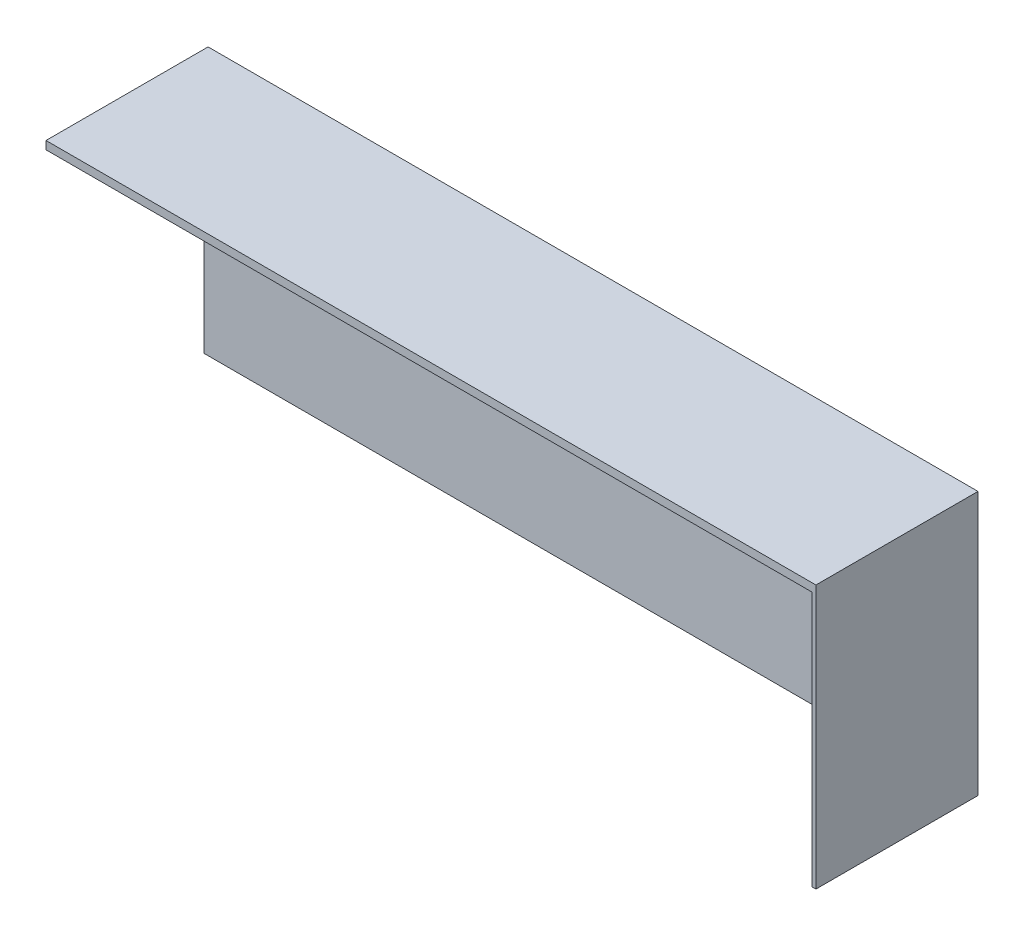
from build123d import *

# Parameters (mm, degrees)
BOSS_EXTRUDE1_DEPTH = 650
SKETCH3_W           = 1900
SKETCH3_H           = 400
BOSS_EXTRUDE2_DEPTH = 20


with BuildPart() as part:
    # Sketch2 → Boss-Extrude1 (new body)
    with BuildSketch(Plane(origin=(0, 0, 0), x_dir=(1, 0, 0), z_dir=(0, 1, 0))):
        Polygon((-1900, 0), (0, 0), (0, -400), (-10, -400), (-10, -10), (-1900, -10), align=None)
    extrude(amount=BOSS_EXTRUDE1_DEPTH)

    # Sketch3 → Boss-Extrude2 (add)
    with BuildSketch(Plane(origin=(0, 650, 0), x_dir=(1, 0, 0), z_dir=(0, 1, 0))):
        with Locations((-950, -200)):
            Rectangle(SKETCH3_W, SKETCH3_H)
    extrude(amount=-BOSS_EXTRUDE2_DEPTH)


solid = part.part
